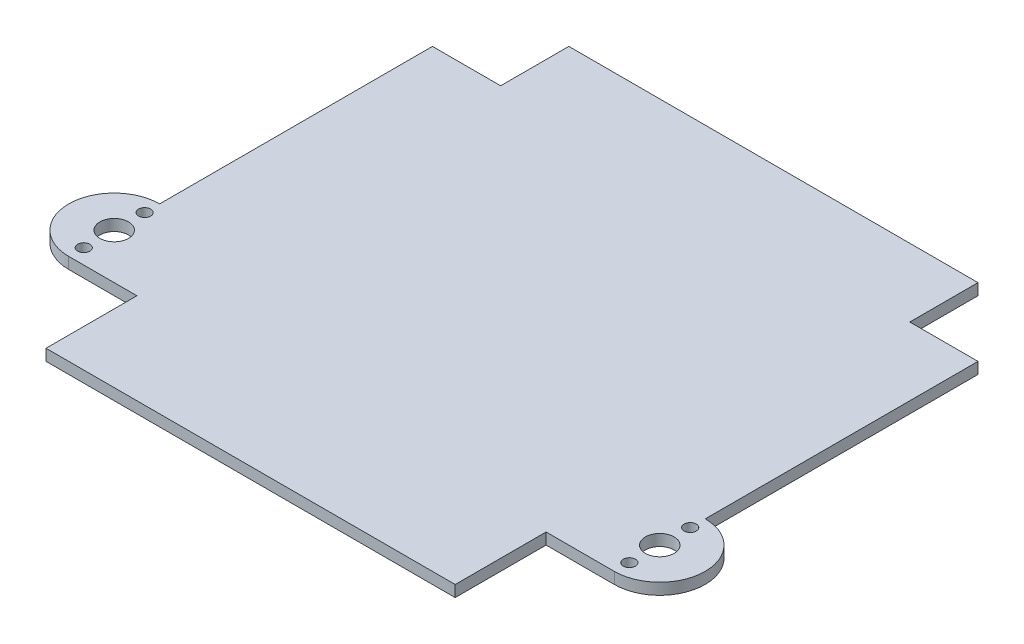
from build123d import *

# Parameters (mm, degrees)
SKETCH1_W                = 114.3
SKETCH1_H                = 101.6
BOSS_EXTRUDE1_DEPTH      = 3.175
SKETCH2_W                = 114.3
SKETCH2_H                = 25.4
SKETCH2_H_2              = 19.05
BOSS_EXTRUDE2_DEPTH      = 3.175
M3_CLEARANCE_HOLE1_D     = 3.4
M3_CLEARANCE_HOLE1_DEPTH = 6.35
M3_CLEARANCE_HOLE1_TIP   = 1.021463052


with BuildPart() as part:
    # Sketch1 → Boss-Extrude1 (new body)
    with BuildSketch(Plane(origin=(0, 0, 0), x_dir=(1, 0, 0), z_dir=(0, 1, 0))):
        Rectangle(SKETCH1_W, SKETCH1_H)
    extrude(amount=BOSS_EXTRUDE1_DEPTH)

    # Sketch2 → Boss-Extrude2 (add)
    # profile 1 of 4: a face of its own
    with BuildSketch(Plane(origin=(0, 3.175, 0), x_dir=(1, 0, 0), z_dir=(0, 1, 0))):
        with BuildLine():
            Line((-76.2, -50.8), (-57.15, -50.8))
            Line((-57.15, -50.8), (-57.15, 50.8))
            Line((-57.15, 50.8), (-76.2, 50.8))
            Line((-76.2, 50.8), (-76.2, -25.4))
            ThreePointArc((-76.2, -25.4), (-88.9, -38.1), (-76.2, -50.8))
        make_face()
        with BuildLine():
            ThreePointArc((-76.2, -34.1), (-72.2, -38.1), (-76.2, -42.1))
            ThreePointArc((-76.2, -42.1), (-80.2, -38.1), (-76.2, -34.1))
        make_face(mode=Mode.SUBTRACT)
    # profile 2 of 4: a face of its own
    with BuildSketch(Plane(origin=(0, 3.175, 0), x_dir=(1, 0, 0), z_dir=(0, 1, 0))):
        with Locations((0, -63.5)):
            Rectangle(SKETCH2_W, SKETCH2_H)
    # profile 3 of 4: a face of its own
    with BuildSketch(Plane(origin=(0, 3.175, 0), x_dir=(1, 0, 0), z_dir=(0, 1, 0))):
        with BuildLine():
            Line((57.15, -50.8), (76.2, -50.8))
            ThreePointArc((76.2, -50.8), (88.9, -38.1), (76.2, -25.4))
            Line((76.2, -25.4), (76.2, 50.8))
            Line((76.2, 50.8), (57.15, 50.8))
            Line((57.15, 50.8), (57.15, -50.8))
        make_face()
        with BuildLine():
            ThreePointArc((76.2, -42.1), (72.2, -38.1), (76.2, -34.1))
            ThreePointArc((76.2, -34.1), (80.2, -38.1), (76.2, -42.1))
        make_face(mode=Mode.SUBTRACT)
    # profile 4 of 4: a face of its own
    with BuildSketch(Plane(origin=(0, 3.175, 0), x_dir=(1, 0, 0), z_dir=(0, 1, 0))):
        with Locations((0, 60.325)):
            Rectangle(SKETCH2_W, SKETCH2_H_2)
    extrude(amount=-BOSS_EXTRUDE2_DEPTH)

    # M3 Clearance Hole1
    with Locations(Plane(origin=(0, 3.175, 0), x_dir=(1, 0, 0), z_dir=(0, 1, 0))):
        with Locations((-76.2, -29.6), (-76.2, -46.6), (76.2, -29.6), (76.2, -46.6)):
            Hole(M3_CLEARANCE_HOLE1_D / 2, depth=M3_CLEARANCE_HOLE1_DEPTH)
            with Locations((0, 0, -(M3_CLEARANCE_HOLE1_DEPTH + M3_CLEARANCE_HOLE1_TIP / 2))):  # 118° drill point
                Cone(0, M3_CLEARANCE_HOLE1_D / 2, M3_CLEARANCE_HOLE1_TIP, mode=Mode.SUBTRACT)


solid = part.part
